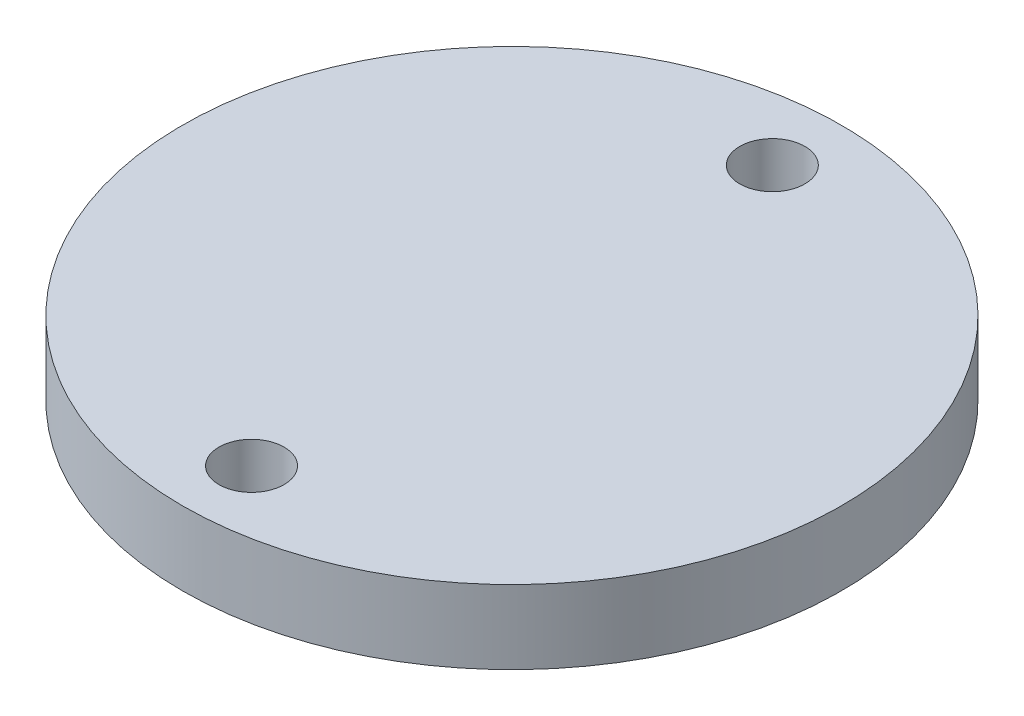
from build123d import *

# Parameters (mm, degrees)
SKETCH1_R           = 10.287
BOSS_EXTRUDE1_DEPTH = 2.3
SKETCH2_R           = 4.4
BOSS_EXTRUDE2_DEPTH = 3.3
SKETCH4_R           = 1.016
CUT_EXTRUDE1_DEPTH  = 2.3


with BuildPart() as part:
    # Sketch1 → Boss-Extrude1 (new body)
    with BuildSketch(Plane(origin=(0, 0, 0), x_dir=(1, 0, 0), z_dir=(0, 1, 0))):
        with Locations(Location((0, 0, 0), (0, 0, 270))):
            Circle(SKETCH1_R)
    extrude(amount=BOSS_EXTRUDE1_DEPTH)

    # Sketch2 → Boss-Extrude2 (add)
    with BuildSketch(Plane(origin=(0, 0, 0), x_dir=(-1, 0, 0), z_dir=(0, -1, 0))):
        with Locations(Location((0, 0, 0), (0, 0, 90))):
            Circle(SKETCH2_R)
    extrude(amount=BOSS_EXTRUDE2_DEPTH)

    # Sketch4 → Cut-Extrude1 (cut)
    with BuildSketch(Plane(origin=(0, 0, 0), x_dir=(1, 0, 0), z_dir=(0, 1, 0))):
        with Locations(Location((0, 8.128, 0), (0, 0, 270))):
            Circle(SKETCH4_R)
        with Locations(Location((0, -8.128, 0), (0, 0, 270))):
            Circle(SKETCH4_R)
    extrude(amount=CUT_EXTRUDE1_DEPTH, mode=Mode.SUBTRACT)


solid = part.part
